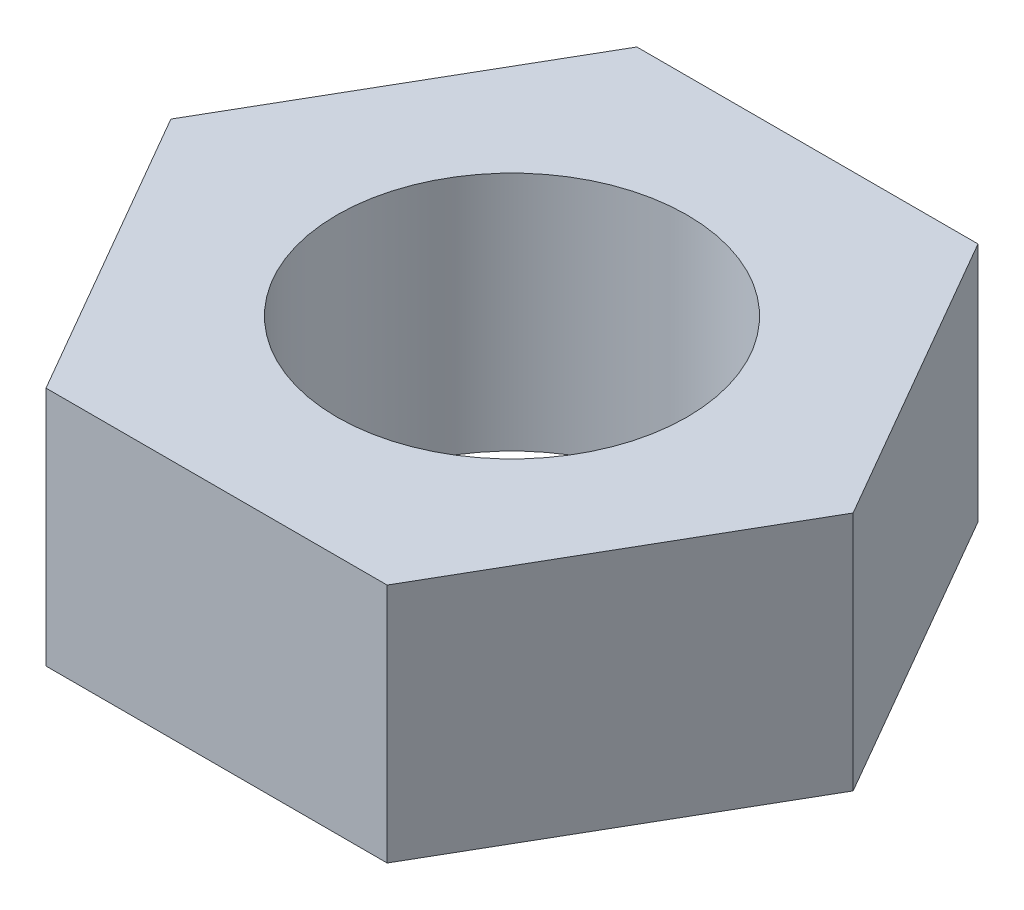
from build123d import *

# Parameters (mm, degrees)
SKETCH1_R           = 4
BOSS_EXTRUDE1_DEPTH = 5.5


with BuildPart() as part:
    # Sketch1 → Boss-Extrude1 (new body)
    with BuildSketch(Plane(origin=(0, 0, 0), x_dir=(1, 0, 0), z_dir=(0, 1, 0))):
        Polygon((7.794228634, 0), (3.897114317, 6.75), (-3.897114317, 6.75), (-7.794228634, 0), (-3.897114317, -6.75), (3.897114317, -6.75), align=None)
        with Locations(Location((0, 0, 0), (0, 0, 270))):
            Circle(SKETCH1_R, mode=Mode.SUBTRACT)
    extrude(amount=BOSS_EXTRUDE1_DEPTH)


solid = part.part
